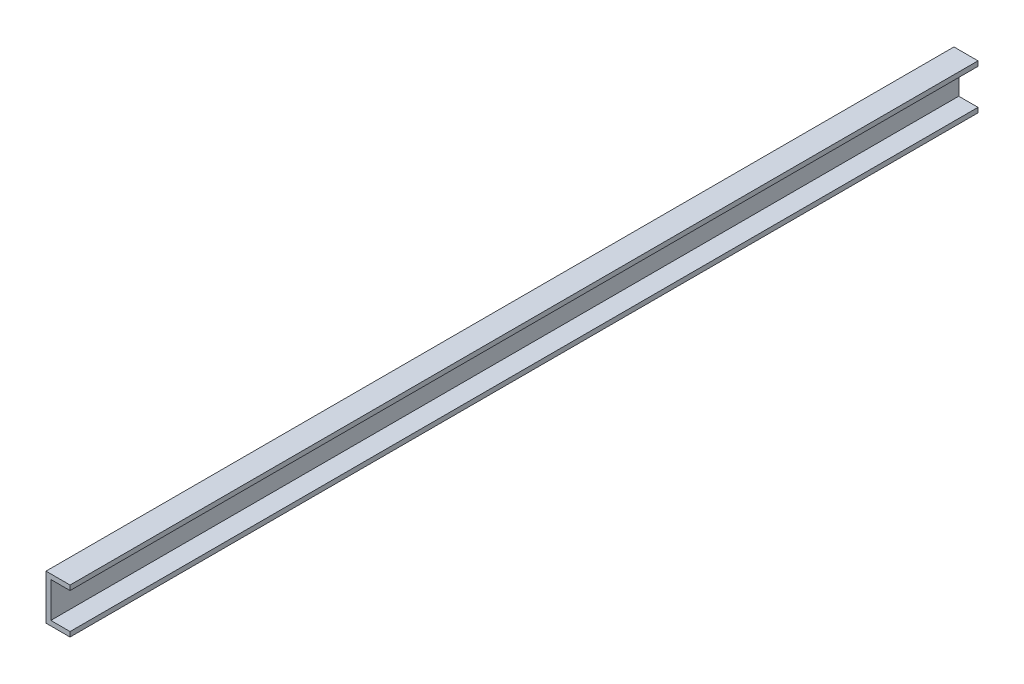
from build123d import *

# Parameters (mm, degrees)
C_CHANNEL_80_X_8_1_DEPTH = 1510


with BuildPart() as part:
    # Sketch11 → C channel 80 X 8(1) (new body)
    with BuildSketch(Plane(origin=(0, 0, 755), x_dir=(-1, 0, 0), z_dir=(0, 0, -1))):
        Polygon((0, -37.5), (0, 37.5), (-40, 37.5), (-40, 29.5), (-8, 29.5), (-8, -29.5), (-40, -29.5), (-40, -37.5), align=None)
    extrude(amount=C_CHANNEL_80_X_8_1_DEPTH)


solid = part.part
